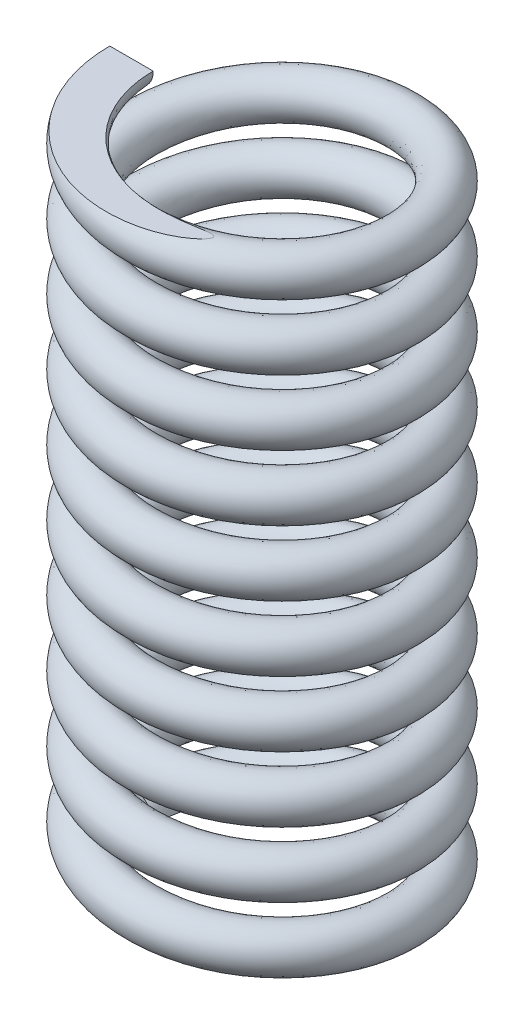
from build123d import *

# Parameters (mm, degrees)
SWEEP1_PITCH            = 1.2
SWEEP1_HEIGHT           = 12
SWEEP1_RADIUS           = 2.4
SWEEP1_START_ANGLE      = -90
SKETCH2_R               = 0.4
CUT_EXTRUDE1_DEPTH      = 14.016918694
CUT_EXTRUDE1_DEPTH_BACK = 14.016918694
SKETCH3_OUTSIDE_W       = 10.61
SKETCH3_OUTSIDE_H       = 17.81
SKETCH3_OUTSIDE_W_2     = 10.6
SKETCH3_OUTSIDE_H_2     = 12


with BuildPart() as part:
    # Sweep1: sweep along a helix
    with BuildLine() as sweep1_path:
        add(Helix(SWEEP1_PITCH, SWEEP1_HEIGHT, SWEEP1_RADIUS, center=(0, 0, 0), direction=(0, 1, 0), lefthand=True, mode=Mode.PRIVATE).rotate(Axis((0, 0, 0), (0, 1, 0)), SWEEP1_START_ANGLE))
    # Sketch2 → Sweep1 (sweep)
    with BuildSketch(Plane.XY):
        with Locations((-2.4, 0)):
            Circle(SKETCH2_R)
    sweep(path=sweep1_path.line, is_frenet=True)

    # Sketch3 outside → Cut-Extrude1 (cut, two sides: drawn at the far end of the back side and taken through both)
    with BuildSketch(Plane(origin=(0, 0, 0), x_dir=(0, 0, -1), z_dir=(1, 0, 0)).offset(-CUT_EXTRUDE1_DEPTH_BACK)):
        with Locations((0, 6)):
            Rectangle(SKETCH3_OUTSIDE_W, SKETCH3_OUTSIDE_H)
        with Locations((0, 6)):
            Rectangle(SKETCH3_OUTSIDE_W_2, SKETCH3_OUTSIDE_H_2, mode=Mode.SUBTRACT)
    extrude(amount=CUT_EXTRUDE1_DEPTH + CUT_EXTRUDE1_DEPTH_BACK, mode=Mode.SUBTRACT)


solid = part.part
